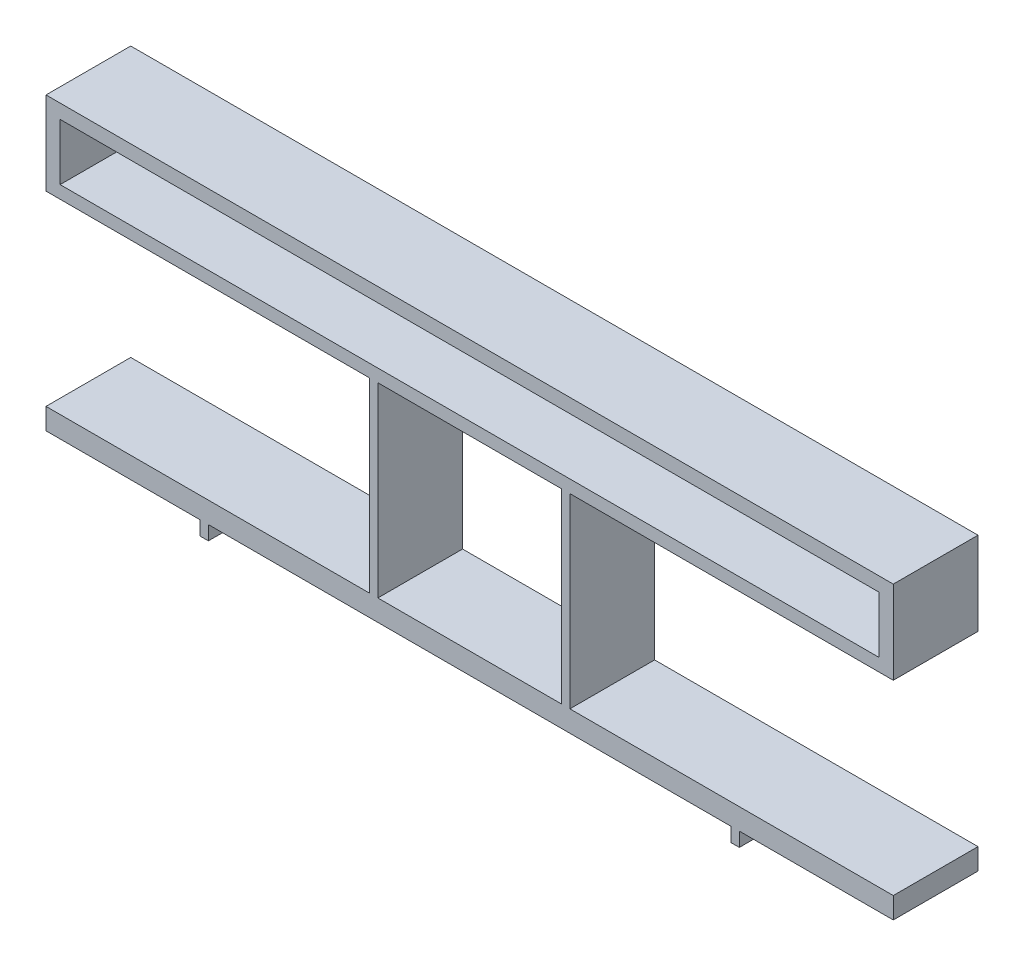
from build123d import *

# Parameters (mm, degrees)
SKETCH2_W           = 300
SKETCH2_H           = 7.5
BOSS_EXTRUDE1_DEPTH = 30
SKETCH3_W           = 3
SKETCH3_H           = 30
BOSS_EXTRUDE2_DEPTH = 5
SKETCH4_W           = 3
SKETCH4_H           = 30
BOSS_EXTRUDE3_DEPTH = 66
SKETCH5_W           = 300
SKETCH5_H           = 30
BOSS_EXTRUDE4_DEPTH = 29.5
SKETCH6_W           = 290
SKETCH6_H           = 20
CUT_EXTRUDE1_DEPTH  = 306.68909869


with BuildPart() as part:
    # Sketch2 → Boss-Extrude1 (new body)
    with BuildSketch(Plane.XY):
        with Locations((137.761363636, -0.5625)):
            Rectangle(SKETCH2_W, SKETCH2_H)
    extrude(amount=BOSS_EXTRUDE1_DEPTH)

    # Sketch3 → Boss-Extrude2 (add)
    with BuildSketch(Plane.XZ.offset(4.3125)):
        with Locations((231.761363636, 15)):
            Rectangle(SKETCH3_W, SKETCH3_H)
        with Locations((43.761363636, 15)):
            Rectangle(SKETCH3_W, SKETCH3_H)
    extrude(amount=BOSS_EXTRUDE2_DEPTH)

    # Sketch4 → Boss-Extrude3 (add)
    with BuildSketch(Plane(origin=(0, 3.1875, 0), x_dir=(1, 0, 0), z_dir=(0, 1, 0))):
        with Locations((171.761363636, -15)):
            Rectangle(SKETCH4_W, SKETCH4_H)
        with Locations((103.761363636, -15)):
            Rectangle(SKETCH4_W, SKETCH4_H)
    extrude(amount=BOSS_EXTRUDE3_DEPTH)

    # Sketch5 → Boss-Extrude4 (add)
    with BuildSketch(Plane(origin=(0, 69.1875, 0), x_dir=(1, 0, 0), z_dir=(0, 1, 0))):
        with Locations((137.761363636, -15)):
            Rectangle(SKETCH5_W, SKETCH5_H)
    extrude(amount=BOSS_EXTRUDE4_DEPTH)

    # Sketch6 → Cut-Extrude1 (cut, through all)
    with BuildSketch(Plane(origin=(0, 0, 0), x_dir=(-1, 0, 0), z_dir=(0, 0, -1))):
        with Locations((-137.761363636, 83.6875)):
            Rectangle(SKETCH6_W, SKETCH6_H)
    extrude(amount=-CUT_EXTRUDE1_DEPTH, mode=Mode.SUBTRACT)


solid = part.part
